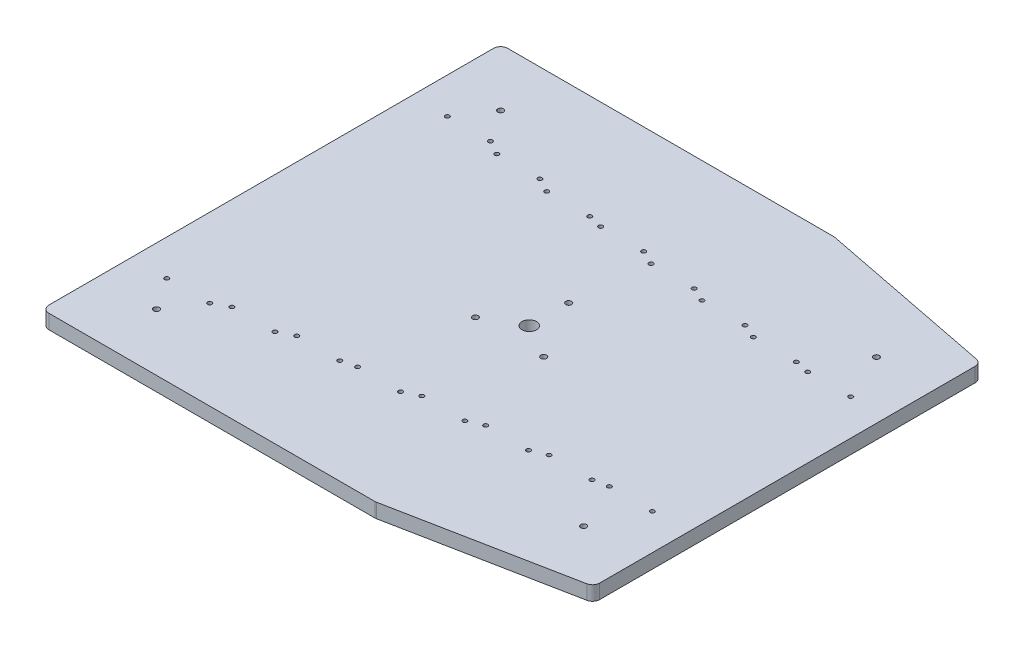
from build123d import *

# Parameters (mm, degrees)
SKETCH1_W              = 457.2
SKETCH1_H              = 406.4
BOSS_EXTRUDE1_DEPTH    = 12.7
F_6_CLEARANCE_HOLE1_D  = 3.7973
SKETCH5_R              = 6.4135
CUT_EXTRUDE2_DEPTH     = 307.120058147
CUT_EXTRUDE3_DEPTH     = 3.175
F_10_CLEARANCE_HOLE1_D = 5.1054
CUT_EXTRUDE4_DEPTH     = 307.120058147
FILLET1_R              = 6.35
F_10_CLEARANCE_HOLE2_D = 5.1054
SKETCH18_R             = 6.985
CUT_EXTRUDE6_DEPTH     = 4.7625


with BuildPart() as part:
    # Sketch1 → Boss-Extrude1 (new body)
    with BuildSketch(Plane(origin=(0, 0, 0), x_dir=(1, 0, 0), z_dir=(0, 1, 0))):
        Rectangle(SKETCH1_W, SKETCH1_H)
    extrude(amount=BOSS_EXTRUDE1_DEPTH)

    # #6 Clearance Hole1 (through all)
    with Locations(Plane(origin=(0, 0, 0), x_dir=(-1, 0, 0), z_dir=(0, -1, 0))):
        with Locations((-196.85, 87.87638), (-158.75, 87.87638), (-146.05, 90.45448), (-107.95, 90.45448), (-95.25, 95.83166), (-57.15, 95.83166), (-44.45, 101.50348), (-6.35, 101.50348), (6.35, 107.61726), (44.45, 107.61726), (57.15, 110.71098), (95.25, 110.71098), (107.95, 117.34038), (146.05, 117.34038), (158.75, 124.26442), (196.85, 124.26442), (196.85, -124.26442), (158.75, -124.26442), (146.05, -117.34038), (107.95, -117.34038), (95.25, -110.71098), (57.15, -110.71098), (44.45, -107.61726), (6.35, -107.61726), (-6.35, -101.50348), (-44.45, -101.50348), (-57.15, -95.83166), (-95.25, -95.83166), (-107.95, -90.45448), (-146.05, -90.45448), (-158.75, -87.87638), (-196.85, -87.87638)):
            Hole(F_6_CLEARANCE_HOLE1_D / 2)

    # Sketch5 → Cut-Extrude2 (cut, through all)
    with BuildSketch(Plane.XZ):
        with Locations(Location((0, 0, 0), (0, 0, 270))):
            Circle(SKETCH5_R)
    extrude(amount=-CUT_EXTRUDE2_DEPTH, mode=Mode.SUBTRACT)

    # Sketch6 → Cut-Extrude3 (cut)
    with BuildSketch(Plane.XZ):
        Polygon((-192.913, -121.99139199), (-196.85, -119.71836398), (-200.787, -121.99139199), (-200.787, -126.53744801), (-196.85, -128.81047602), (-192.913, -126.53744801), align=None)
    cut_extrude3 = extrude(amount=-CUT_EXTRUDE3_DEPTH, mode=Mode.SUBTRACT)

    # Sketch-Pattern1: Cut-Extrude3 at 31 more places
    with Locations((393.7, 0, 36.38804), (355.6, 0, 36.38804), (342.9, 0, 33.80994), (304.8, 0, 33.80994), (292.1, 0, 28.43276), (254, 0, 28.43276), (241.3, 0, 22.76094), (203.2, 0, 22.76094), (190.5, 0, 16.64716), (152.4, 0, 16.64716), (139.7, 0, 13.55344), (101.6, 0, 13.55344), (88.9, 0, 6.92404), (50.8, 0, 6.92404), (38.1, 0, 0), (0, 0, 248.52884), (38.1, 0, 248.52884), (50.8, 0, 241.6048), (88.9, 0, 241.6048), (101.6, 0, 234.9754), (139.7, 0, 234.9754), (152.4, 0, 231.88168), (190.5, 0, 231.88168), (203.2, 0, 225.7679), (241.3, 0, 225.7679), (254, 0, 220.09608), (292.1, 0, 220.09608), (304.8, 0, 214.7189), (342.9, 0, 214.7189), (355.6, 0, 212.1408), (393.7, 0, 212.1408)):
        add(cut_extrude3, mode=Mode.SUBTRACT)

    # #10 Clearance Hole1 (through all)
    with Locations(Plane(origin=(0, 12.7, 0), x_dir=(1, 0, 0), z_dir=(0, 1, 0))):
        with Locations((-30.245937227, -17.4625), (0, 34.925), (30.245937227, -17.4625)):
            Hole(F_10_CLEARANCE_HOLE1_D / 2)

    # Sketch10 → Cut-Extrude4 (cut, through all)
    with BuildSketch(Plane(origin=(0, 12.7, 0), x_dir=(1, 0, 0), z_dir=(0, 1, 0))):
        Polygon((67.035234154, -203.2), (228.6, -171.45), (228.6, -203.2), align=None)
        Polygon((228.6, 203.2), (67.035234154, 203.2), (228.6, 171.45), align=None)
    extrude(amount=-CUT_EXTRUDE4_DEPTH, mode=Mode.SUBTRACT)

    # Fillet1
    fillet1_edges = [part.edges().sort_by_distance(p)[0] for p in [
        (67.035234154, 6.35, 203.2),
        (228.6, 6.35, 171.45),
        (228.6, 6.35, -171.45),
        (67.035234154, 6.35, -203.2),
        (-228.6, 6.35, 203.2),
        (-228.6, 6.35, -203.2),
    ]]
    fillet(fillet1_edges, radius=FILLET1_R)

    # #10 Clearance Hole2 (through all)
    with Locations(Plane(origin=(0, 12.7, 0), x_dir=(1, 0, 0), z_dir=(0, 1, 0))):
        with Locations((177.8, -129.661378082), (-177.8, -152.4), (-177.8, 152.4), (177.8, 129.661378082)):
            Hole(F_10_CLEARANCE_HOLE2_D / 2)

    # Sketch18 → Cut-Extrude6 (cut)
    with BuildSketch(Plane.XZ):
        with Locations(Location((-196.85, -124.26442, 0), (0, 0, 270))):
            Circle(SKETCH18_R)
    cut_extrude6 = extrude(amount=-CUT_EXTRUDE6_DEPTH, mode=Mode.SUBTRACT)

    # Sketch-Pattern2: Cut-Extrude6 at 31 more places
    with Locations((393.7, 0, 36.38804), (355.6, 0, 36.38804), (342.9, 0, 33.80994), (304.8, 0, 33.80994), (292.1, 0, 28.43276), (254, 0, 28.43276), (241.3, 0, 22.76094), (203.2, 0, 22.76094), (190.5, 0, 16.64716), (152.4, 0, 16.64716), (139.7, 0, 13.55344), (101.6, 0, 13.55344), (88.9, 0, 6.92404), (50.8, 0, 6.92404), (38.1, 0, 0), (0, 0, 248.52884), (38.1, 0, 248.52884), (50.8, 0, 241.6048), (88.9, 0, 241.6048), (101.6, 0, 234.9754), (139.7, 0, 234.9754), (152.4, 0, 231.88168), (190.5, 0, 231.88168), (203.2, 0, 225.7679), (241.3, 0, 225.7679), (254, 0, 220.09608), (292.1, 0, 220.09608), (304.8, 0, 214.7189), (342.9, 0, 214.7189), (355.6, 0, 212.1408), (393.7, 0, 212.1408)):
        add(cut_extrude6, mode=Mode.SUBTRACT)


solid = part.part
